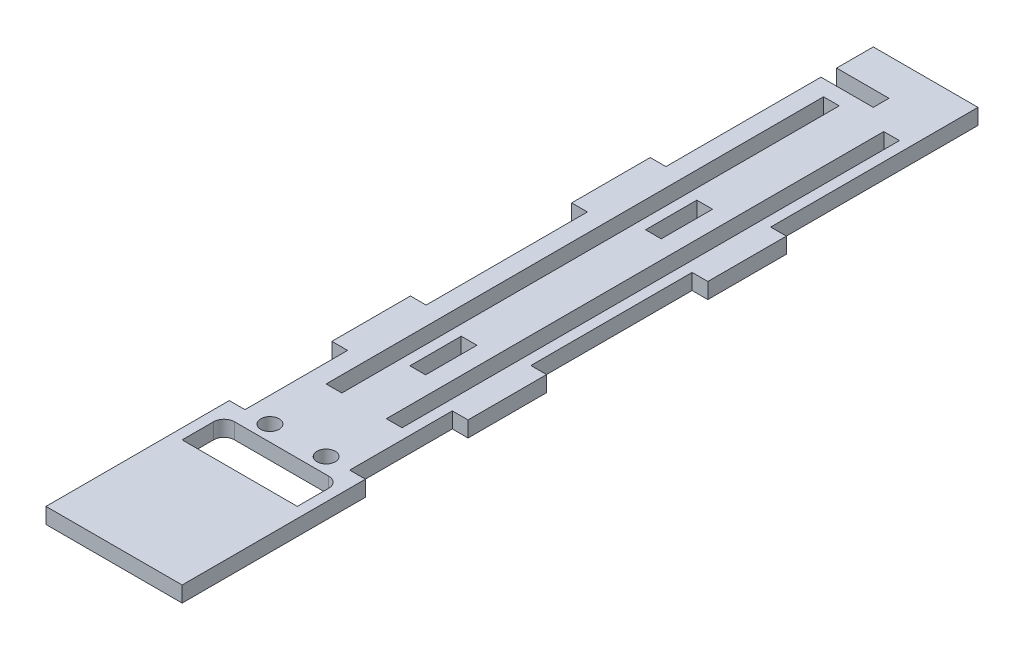
from build123d import *

# Parameters (mm, degrees)
EXTRUDE_1_DEPTH     = 3
SKETCH_3_W          = 3
SKETCH_3_H          = 9.8
CUT_EXTRUDE_1_DEPTH = 10
SKETCH_4_W          = 26
SKETCH_4_H          = 35
EXTRUDE_2_DEPTH     = 3
SKETCH_5_W          = 22
SKETCH_5_H          = 8
CUT_EXTRUDE_2_DEPTH = 19
SKETCH_6_W          = 3
SKETCH_6_H          = 95
CUT_EXTRUDE_3_DEPTH = 25
FILLET_1_R          = 2
SKETCH_7_R          = 1.75
CUT_EXTRUDE_4_DEPTH = 10
SKETCH_8_R          = 1.75
SKETCH_8_W          = 3
SKETCH_8_H          = 95
CUT_EXTRUDE_5_DEPTH = 10


with BuildPart() as part:
    # Эскиз2 → Бобышка-Вытянуть1 (new body)
    with BuildSketch(Plane(origin=(0, 0, 0), x_dir=(1, 0, 0), z_dir=(0, 1, 0))):
        Polygon((-10, -60), (10, -60), (10, -40.4), (13, -40.4), (13, -25.4), (10, -25.4), (10, 5.4), (13, 5.4), (13, 20.4), (10, 20.4), (10, 60), (-10, 60), (-10, 53), (0, 53), (0, 50), (-10, 50), (-10, 20.4), (-13, 20.4), (-13, 5.4), (-10, 5.4), (-10, -25.4), (-13, -25.4), (-13, -40.4), (-10, -40.4), align=None)
    extrude(amount=EXTRUDE_1_DEPTH)

    # Эскиз3 → Вырез-Вытянуть1 (cut)
    with BuildSketch(Plane(origin=(0, 3, 0), x_dir=(1, 0, 0), z_dir=(0, 1, 0))):
        with Locations((0, 12.9)):
            Rectangle(SKETCH_3_W, SKETCH_3_H)
        with Locations((0, -32.1)):
            Rectangle(SKETCH_3_W, SKETCH_3_H)
    extrude(amount=-CUT_EXTRUDE_1_DEPTH, mode=Mode.SUBTRACT)

    # Эскиз4 → Бобышка-Вытянуть2 (add)
    with BuildSketch(Plane.XZ):
        with Locations((0, 77.5)):
            Rectangle(SKETCH_4_W, SKETCH_4_H)
    extrude(amount=-EXTRUDE_2_DEPTH)

    # Эскиз5 → Вырез-Вытянуть2 (cut)
    with BuildSketch(Plane(origin=(0, 0, 0), x_dir=(-1, 0, 0), z_dir=(0, -1, 0))):
        with Locations((0, -67)):
            Rectangle(SKETCH_5_W, SKETCH_5_H)
    extrude(amount=-CUT_EXTRUDE_2_DEPTH, mode=Mode.SUBTRACT)

    # Эскиз6 → Вырез-Вытянуть3 (cut)
    with BuildSketch(Plane.XZ):
        with Locations((6.5, 0.5)):
            Rectangle(SKETCH_6_W, SKETCH_6_H)
    extrude(amount=-CUT_EXTRUDE_3_DEPTH, mode=Mode.SUBTRACT)

    # Скругление1
    fillet_1_edges = [part.edges().sort_by_distance(p)[0] for p in [
        (-11, 1.5, 63),
        (11, 1.5, 63),
    ]]
    fillet(fillet_1_edges, radius=FILLET_1_R)

    # Эскиз7 → Вырез-Вытянуть4 (cut)
    with BuildSketch(Plane.XZ):
        with Locations(Location((5.5, 60, 0), (0, 0, 270))):
            Circle(SKETCH_7_R)
    extrude(amount=-CUT_EXTRUDE_4_DEPTH, mode=Mode.SUBTRACT)

    # Эскиз8 → Вырез-Вытянуть5 (cut)
    with BuildSketch(Plane.XZ):
        with Locations(Location((-5.229687219, 60, 0), (0, 0, 270))):
            Circle(SKETCH_8_R)
        with Locations((-5, 0.5)):
            Rectangle(SKETCH_8_W, SKETCH_8_H)
    extrude(amount=-CUT_EXTRUDE_5_DEPTH, mode=Mode.SUBTRACT)


solid = part.part
